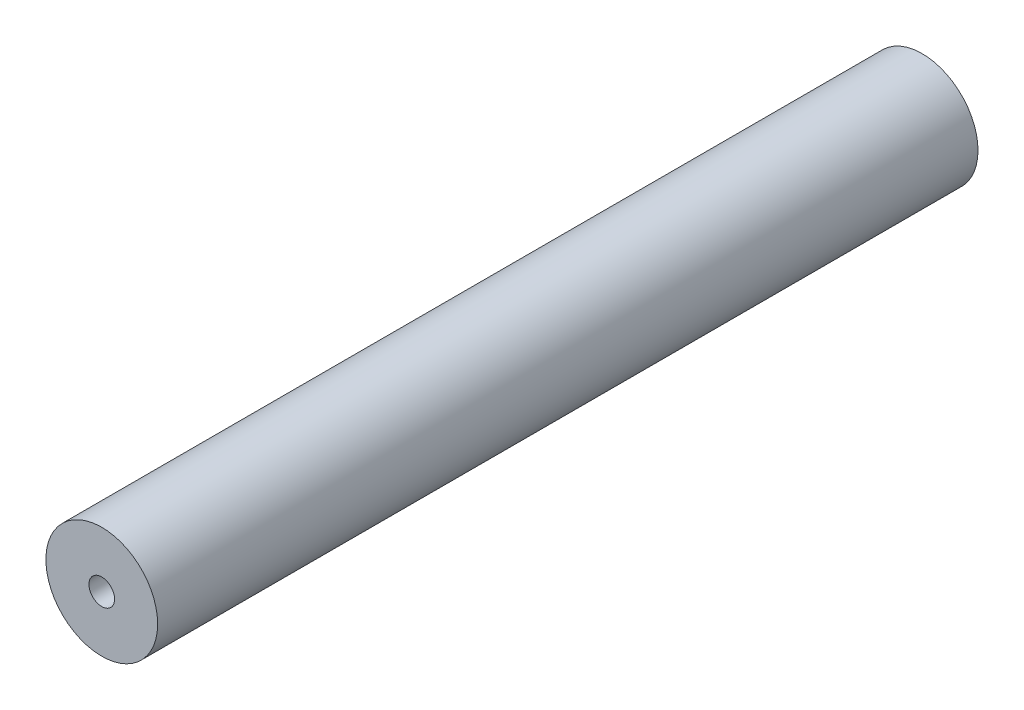
from build123d import *

# Parameters (mm, degrees)
SKETCH1_R                   = 13.839018653
BOSS_EXTRUDE1_DEPTH         = 203.2
F_1_4_0_25_DIAMETER_HOLE1_D = 6.35


with BuildPart() as part:
    # Sketch1 → Boss-Extrude1 (new body)
    with BuildSketch(Plane.XY):
        Circle(SKETCH1_R)
    extrude(amount=BOSS_EXTRUDE1_DEPTH)

    # 1/4 (0.25) Diameter Hole1 (through all)
    with Locations(Plane.XY.offset(203.2)):
        with Locations((0, 0)):
            Hole(F_1_4_0_25_DIAMETER_HOLE1_D / 2)


solid = part.part
